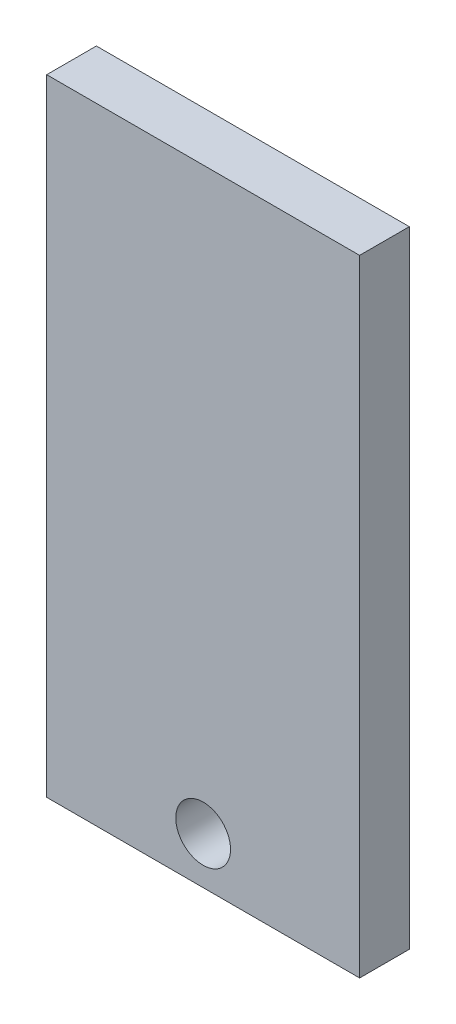
from build123d import *

# Parameters (mm, degrees)
SKETCH1_W           = 40
SKETCH1_H           = 80
BOSS_EXTRUDE1_DEPTH = 6.35
CUT_EXTRUDE1_REACH  = 47.17
SKETCH2_R           = 3.5


with BuildPart() as part:
    # Sketch1 → Boss-Extrude1 (new body)
    with BuildSketch(Plane.XY):
        Rectangle(SKETCH1_W, SKETCH1_H)
    extrude(amount=BOSS_EXTRUDE1_DEPTH)

    # Sketch2 → Cut-Extrude1 (cut, up to next)
    with BuildSketch(Plane.XY.offset(6.35), mode=Mode.PRIVATE) as cut_extrude1_sk1:
        with Locations((0, -34.01945972)):
            Circle(SKETCH2_R)
    cut_extrude1_tool1 = extrude(cut_extrude1_sk1.sketch, amount=-CUT_EXTRUDE1_REACH, mode=Mode.PRIVATE) & part.part
    add(cut_extrude1_tool1.solids().sort_by_distance((0, -34.01946, 6.35))[0], mode=Mode.SUBTRACT)


solid = part.part
